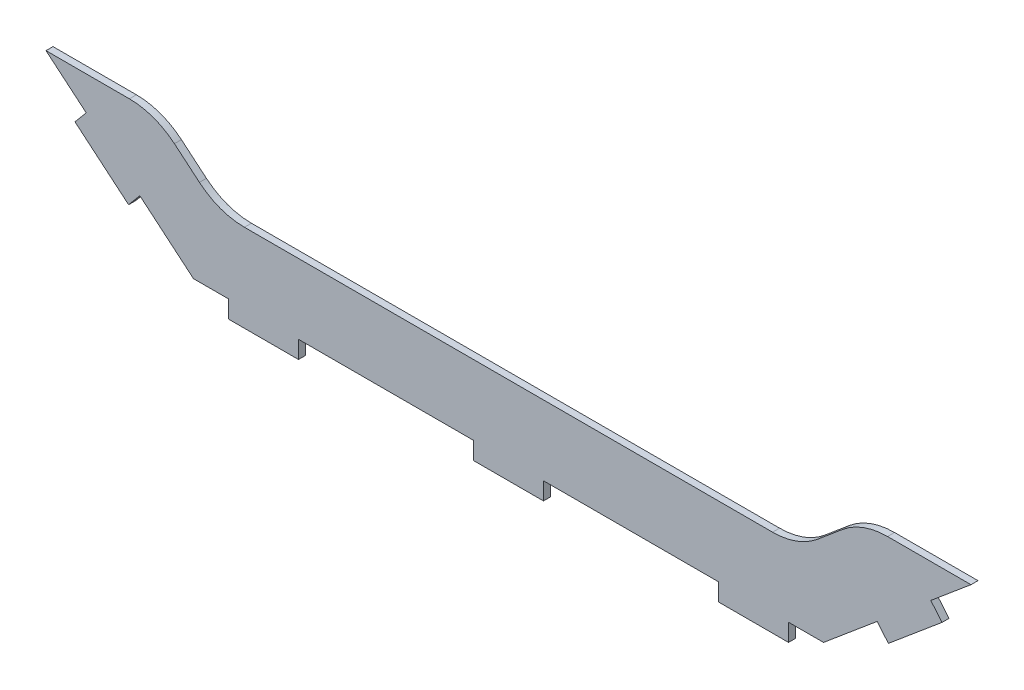
from build123d import *

# Parameters (mm, degrees)
BOSS_EXTRUDE1_DEPTH = 0.05
FILLET1_R           = 1


with BuildPart() as part:
    # frame_outline → Boss-Extrude1 (new, symmetric)
    with BuildSketch(Plane.XY):
        Polygon((0.5, 0), (3, 0), (3, -0.25), (4, -0.25), (4, 0), (4.5, 0), (5.266044443, 0.64278761), (5.426741346, 0.451276499), (6.192785789, 1.094064109), (6.032088886, 1.285575219), (6.606622219, 1.767665927), (5.050898392, 1.767665927), (4.136029766, 1), (-4.136029766, 1), (-5.050898392, 1.767665927), (-6.606622219, 1.767665927), (-6.032088886, 1.285575219), (-6.192785789, 1.094064109), (-5.426741346, 0.451276499), (-5.266044443, 0.64278761), (-4.5, 0), (-4, 0), (-4, -0.25), (-3, -0.25), (-3, 0), (-0.5, 0), (-0.5, -0.25), (0.5, -0.25), align=None)
    extrude(amount=BOSS_EXTRUDE1_DEPTH, both=True)

    # Fillet1
    fillet1_edges = [part.edges().sort_by_distance(p)[0] for p in [
        (-5.050898392, 1.767665927, 0),
        (-4.136029766, 1, 0),
        (4.136029766, 1, 0),
        (5.050898392, 1.767665927, 0),
    ]]
    fillet(fillet1_edges, radius=FILLET1_R)


solid = part.part
